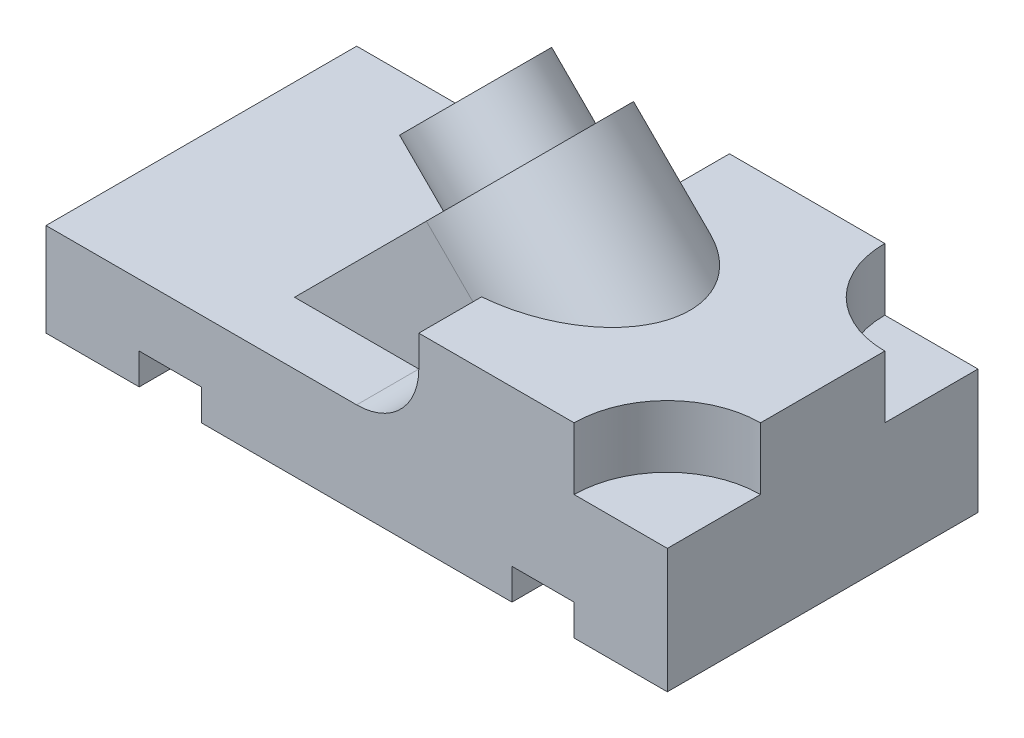
from build123d import *

# Parameters (mm, degrees)
BOSS_EXTRUDE1_DEPTH = 50
BOSS_EXTRUDE2_REACH = 113.636
SKETCH3_R           = 10
SKETCH3_R_2         = 5
BOSS_EXTRUDE3_DEPTH = 10
SKETCH4_R           = 15
CUT_EXTRUDE1_DEPTH  = 10
SKETCH5_W           = 10
SKETCH5_H           = 5
CUT_EXTRUDE2_DEPTH  = 123.622026278


with BuildPart() as part:
    # Sketch1 → Boss-Extrude1 (new body)
    with BuildSketch(Plane.XY):
        with BuildLine():
            Line((0, 0), (100, 0))
            Line((100, 0), (100, 30))
            Line((100, 30), (60, 30))
            Line((60, 30), (60, 25))
            ThreePointArc((60, 25), (57.071067812, 17.928932188), (50, 15))
            Line((50, 15), (0, 15))
            Line((0, 15), (0, 0))
        make_face()
    extrude(amount=-BOSS_EXTRUDE1_DEPTH)

    # Boss-Extrude2: up to this plane
    boss_extrude2_end = Plane(origin=(50, 15, -50), z_dir=(0, 1, 0))
    # Sketch2 → Boss-Extrude2 (add, up to the surface)
    with BuildSketch(Plane(origin=(7.5, -7.5, 0), x_dir=(0, 0, 1), z_dir=(-0.7071067811865489, 0.7071067811865462, 0)), mode=Mode.PRIVATE) as boss_extrude2_sk1:
        with BuildLine():
            Line((-40, 31.826842218), (-10, 31.826842218))
            Line((-10, 31.826842218), (-10, 61.826842218))
            ThreePointArc((-10, 61.826842218), (-25, 76.826842218), (-40, 61.826842218))
            Line((-40, 61.826842218), (-40, 31.826842218))
        make_face()
    boss_extrude2_tool1 = split(extrude(boss_extrude2_sk1.sketch, amount=-BOSS_EXTRUDE2_REACH, mode=Mode.PRIVATE), bisect_by=boss_extrude2_end, keep=Keep.BOTH, mode=Mode.PRIVATE)
    add(boss_extrude2_tool1.solids().sort_by_distance((44.871629, 29.871629, -25))[0])

    # Sketch3 → Boss-Extrude3 (add)
    with BuildSketch(Plane(origin=(7.5, -7.5, 0), x_dir=(0, 0, 1), z_dir=(-0.7071067811865488, 0.7071067811865464, 0))):
        with Locations((-25, 61.826842218)):
            Circle(SKETCH3_R)
        with Locations((-25, 61.826842218)):
            Circle(SKETCH3_R_2, mode=Mode.SUBTRACT)
    extrude(amount=BOSS_EXTRUDE3_DEPTH)

    # Sketch4 → Cut-Extrude1 (cut)
    with BuildSketch(Plane(origin=(0, 30, 0), x_dir=(1, 0, 0), z_dir=(0, 1, 0))):
        with Locations((100, 50)):
            Circle(SKETCH4_R)
        with Locations((100, 0)):
            Circle(SKETCH4_R)
    extrude(amount=-CUT_EXTRUDE1_DEPTH, mode=Mode.SUBTRACT)

    # Sketch5 → Cut-Extrude2 (cut, through all)
    with BuildSketch(Plane.XY):
        with Locations((80, 2.5)):
            Rectangle(SKETCH5_W, SKETCH5_H)
        with Locations((20, 2.5)):
            Rectangle(SKETCH5_W, SKETCH5_H)
    extrude(amount=-CUT_EXTRUDE2_DEPTH, mode=Mode.SUBTRACT)


solid = part.part
